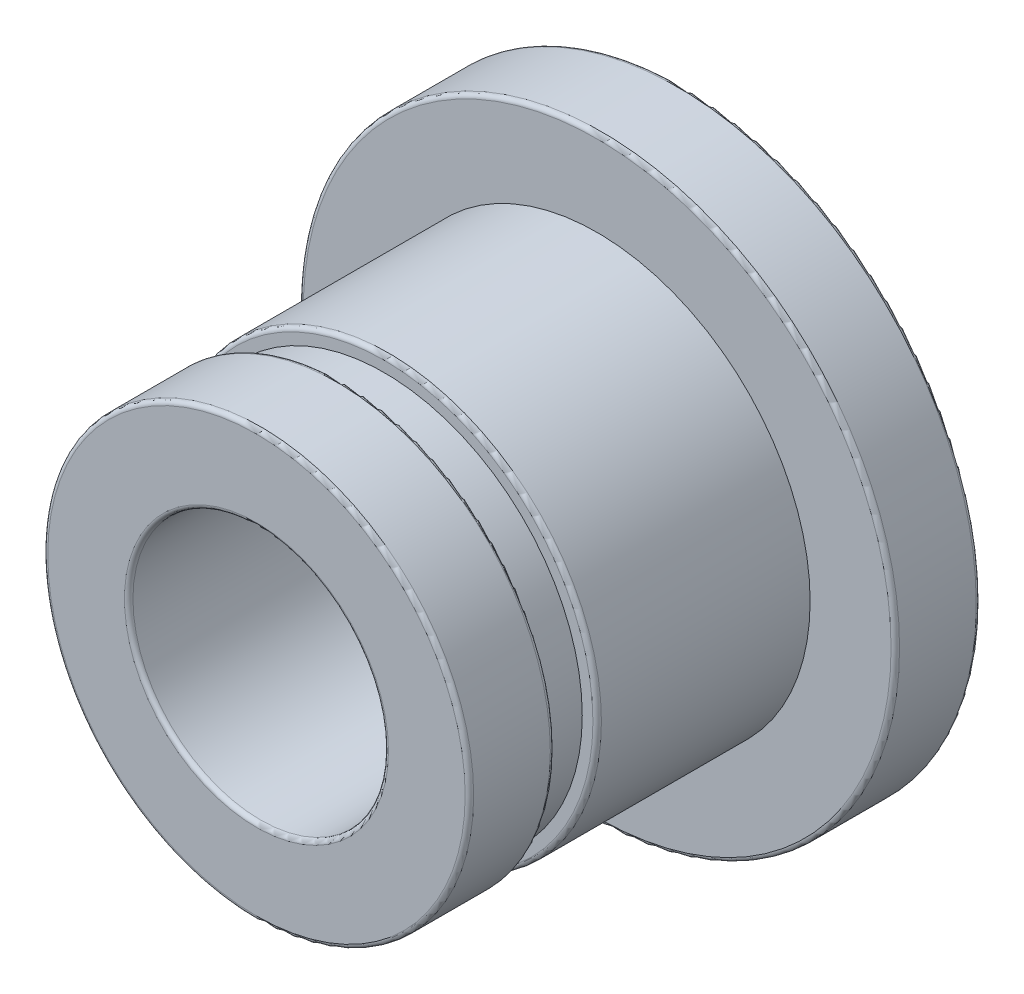
from build123d import *

# Parameters (mm, degrees)
SKETCH1_R          = 7
EXTRUDE1_DEPTH     = 2
SKETCH2_R          = 5
EXTRUDE2_DEPTH     = 8
SKETCH3_R          = 3
CUT_EXTRUDE1_DEPTH = 15.071247279
CUT_EXTRUDE3_START = -3
SKETCH4_R          = 5
SKETCH4_R_2        = 4.65
CUT_EXTRUDE3_DEPTH = 1
FILLET1_R          = 0.1


with BuildPart() as part:
    # Sketch1 → Extrude1 (new body)
    with BuildSketch(Plane.XY):
        Circle(SKETCH1_R)
    extrude(amount=EXTRUDE1_DEPTH)

    # Sketch2 → Extrude2 (add)
    with BuildSketch(Plane.XY.offset(2)):
        Circle(SKETCH2_R)
    extrude(amount=EXTRUDE2_DEPTH)

    # Sketch3 → Cut-Extrude1 (cut, through all)
    with BuildSketch(Plane.XY.offset(10)):
        Circle(SKETCH3_R)
    extrude(amount=-CUT_EXTRUDE1_DEPTH, mode=Mode.SUBTRACT)

    # Sketch4 → Cut-Extrude3 (cut)
    with BuildSketch(Plane.XY.offset(10).offset(CUT_EXTRUDE3_START)):
        Circle(SKETCH4_R)
        Circle(SKETCH4_R_2, mode=Mode.SUBTRACT)
    extrude(amount=CUT_EXTRUDE3_DEPTH, mode=Mode.SUBTRACT)

    # Fillet1
    fillet1_edges = [part.edges().sort_by_distance(p)[0] for p in [
        (-3, 0, 0),
        (-3, 0, 10),
        (-5, 0, 7),
        (-5, 0, 8),
        (-7, 0, 0),
        (-7, 0, 2),
        (-5, 0, 10),
    ]]
    fillet(fillet1_edges, radius=FILLET1_R)


solid = part.part
